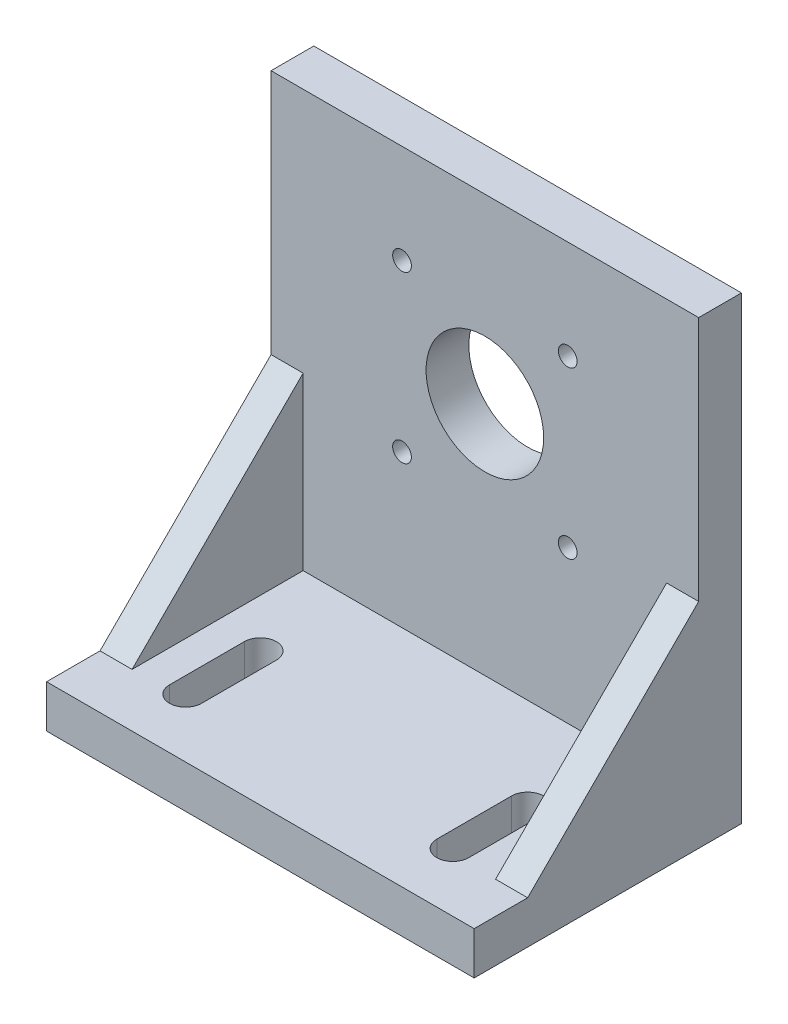
from build123d import *

# Parameters (mm, degrees)
SKETCH_3_W          = 80
SKETCH_3_H          = 50
EXTRUDE_3_DEPTH     = 8
SKETCH_4_W          = 80
SKETCH_4_H          = 86
EXTRUDE_4_DEPTH     = 8
SKETCH_7_W          = 100
SKETCH_7_H          = 18
CUT_EXTRUDE_1_DEPTH = 95
CUT_EXTRUDE_2_DEPTH = 87
SKETCH_9_R          = 11
CUT_EXTRUDE_3_DEPTH = 104.730419839
SKETCH_10_R         = 1.75
CUT_EXTRUDE_4_DEPTH = 104.730419839
EXTRUDE_7_DEPTH     = 6
EXTRUDE_8_DEPTH     = 6


with BuildPart() as part:
    # 草图3 → 凸台-拉伸3 (new body)
    with BuildSketch(Plane(origin=(0, 0, 0), x_dir=(1, 0, 0), z_dir=(0, 1, 0))):
        with Locations((0, -17)):
            Rectangle(SKETCH_3_W, SKETCH_3_H)
    extrude(amount=EXTRUDE_3_DEPTH)

    # 草图4 → 凸台-拉伸4 (add)
    with BuildSketch(Plane.XY):
        with Locations((0, 51)):
            Rectangle(SKETCH_4_W, SKETCH_4_H)
    extrude(amount=-EXTRUDE_4_DEPTH)

    # 草图7 → 切除-拉伸1 (cut, symmetric)
    with BuildSketch(Plane.XY):
        with Locations((0, 95)):
            Rectangle(SKETCH_7_W, SKETCH_7_H)
    extrude(amount=CUT_EXTRUDE_1_DEPTH, both=True, mode=Mode.SUBTRACT)

    # 草图8 → 切除-拉伸2 (cut, symmetric)
    with BuildSketch(Plane(origin=(0, 8, 0), x_dir=(1, 0, 0), z_dir=(0, 1, 0))):
        with BuildLine():
            Line((-22, -17), (-22, -31))
            ThreePointArc((-22, -31), (-25, -34), (-28, -31))
            Line((-28, -31), (-28, -17))
            ThreePointArc((-28, -17), (-25, -14), (-22, -17))
        make_face()
        with BuildLine():
            Line((28, -17), (28, -31))
            ThreePointArc((28, -31), (25, -34), (22, -31))
            Line((22, -31), (22, -17))
            ThreePointArc((22, -17), (25, -14), (28, -17))
        make_face()
    extrude(amount=CUT_EXTRUDE_2_DEPTH, both=True, mode=Mode.SUBTRACT)

    # 草图9 → 切除-拉伸3 (cut, through all)
    with BuildSketch(Plane.XY):
        with Locations((0, 52)):
            Circle(SKETCH_9_R)
    extrude(amount=-CUT_EXTRUDE_3_DEPTH, mode=Mode.SUBTRACT)

    # 草图10 → 切除-拉伸4 (cut, through all)
    with BuildSketch(Plane.XY):
        with Locations((-15.5, 67.5)):
            Circle(SKETCH_10_R)
        with Locations((15.5, 67.5)):
            Circle(SKETCH_10_R)
        with Locations((-15.5, 36.5)):
            Circle(SKETCH_10_R)
        with Locations((15.5, 36.5)):
            Circle(SKETCH_10_R)
    extrude(amount=-CUT_EXTRUDE_4_DEPTH, mode=Mode.SUBTRACT)

    # 草图11 → 凸台-拉伸7 (add)
    with BuildSketch(Plane(origin=(-40, 0, 0), x_dir=(0, 0, -1), z_dir=(1, 0, 0))):
        Polygon((0, 8), (-32, 8), (0, 40), align=None)
    extrude(amount=EXTRUDE_7_DEPTH)

    # 草图12 → 凸台-拉伸8 (add)
    with BuildSketch(Plane(origin=(34, 0, 0), x_dir=(0, 0, -1), z_dir=(1, 0, 0))):
        Polygon((0, 8), (-32, 8), (0, 40), align=None)
    extrude(amount=EXTRUDE_8_DEPTH)


solid = part.part
